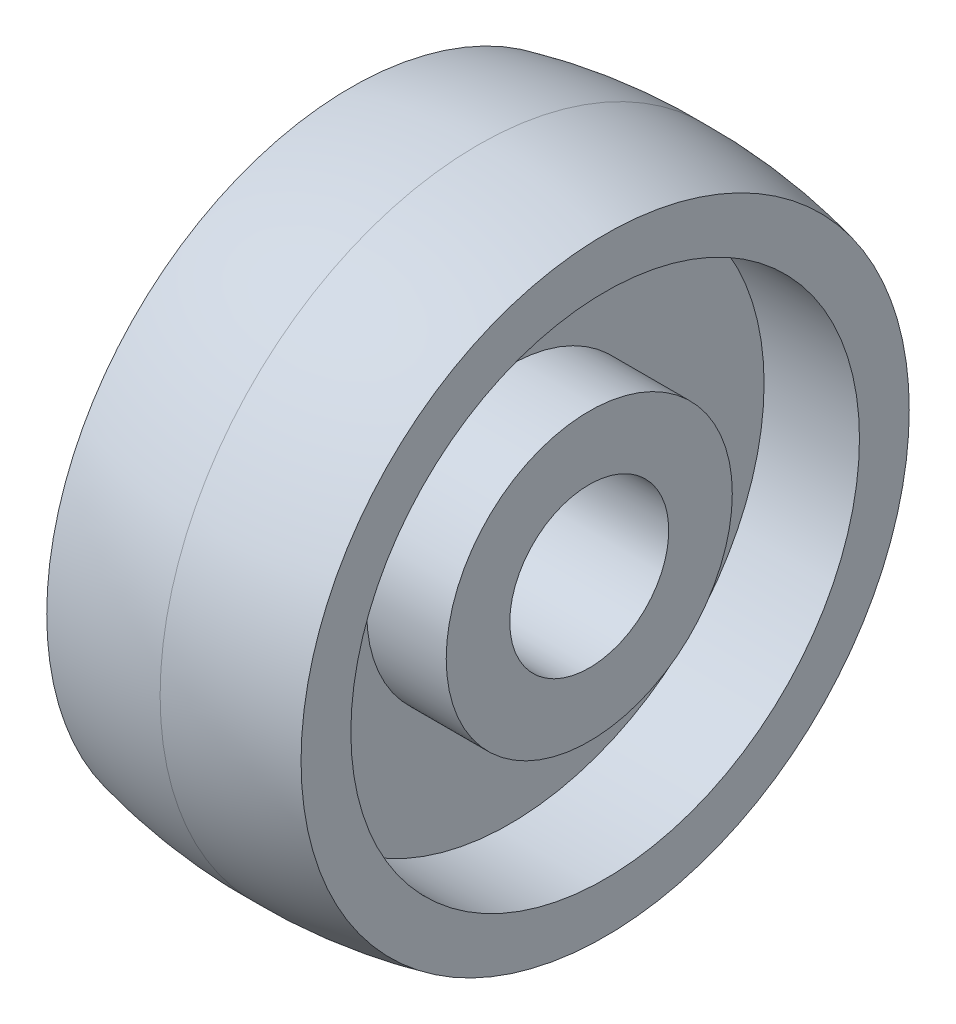
from build123d import *


with BuildPart() as part:
    # 草图1 → 旋转1 (revolve)
    with BuildSketch(Plane.XY, mode=Mode.PRIVATE) as revolve_1_sk:
        with BuildLine():
            Line((-5.246753247, 5), (8.753246753, 5))
            Line((8.753246753, 5), (8.753246753, 9))
            Line((8.753246753, 9), (3.753246753, 9))
            Line((3.753246753, 9), (3.753246753, 16))
            Line((3.753246753, 16), (9.753246753, 16))
            Line((9.753246753, 16), (9.753246753, 19.133240235))
            ThreePointArc((9.753246753, 19.133240235), (5.77897928, 19.804125618), (1.753246753, 20))
            ThreePointArc((1.753246753, 20), (-2.272485773, 19.804125618), (-6.246753247, 19.133240235))
            Line((-6.246753247, 19.133240235), (-6.246753247, 16))
            Line((-6.246753247, 16), (-0.246753247, 16))
            Line((-0.246753247, 16), (-0.246753247, 9))
            Line((-0.246753247, 9), (-5.246753247, 9))
            Line((-5.246753247, 9), (-5.246753247, 5))
        make_face()
    revolve(revolve_1_sk.sketch.rotate(Axis((-14.805194805, 0, 0), (1, 0, 0)), 90), axis=Axis((-14.805194805, 0, 0), (1, 0, 0)))


solid = part.part
